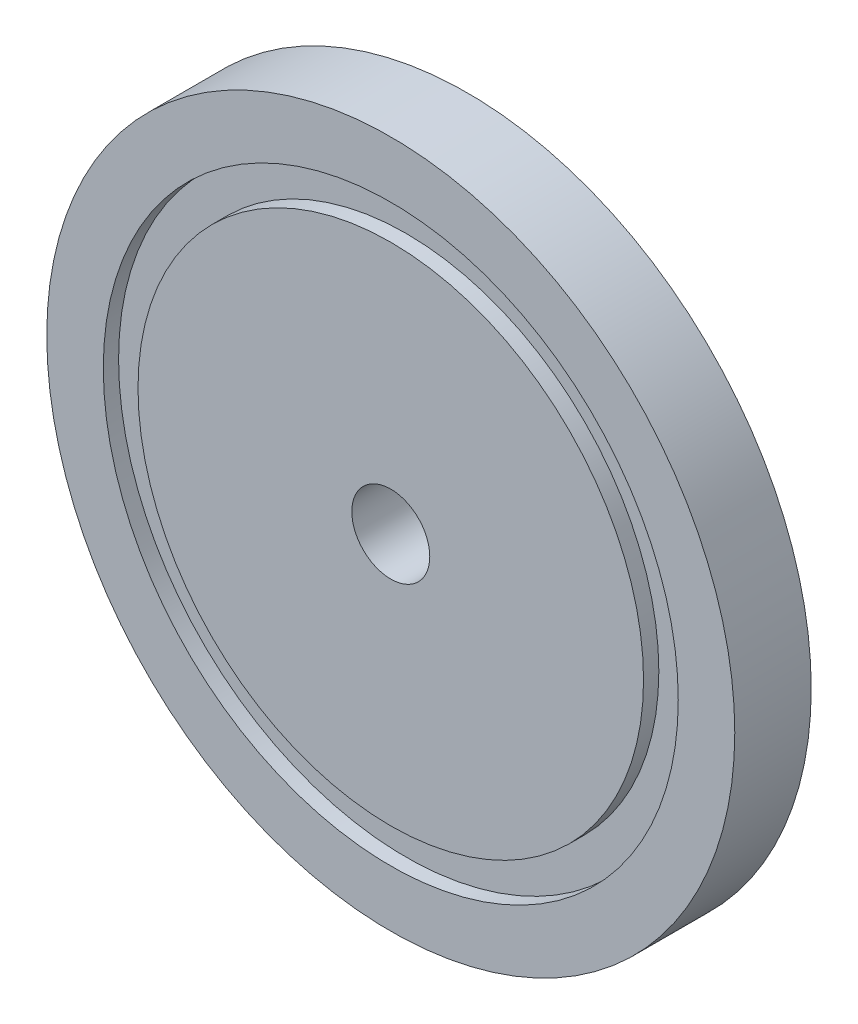
from build123d import *

# Parameters (mm, degrees)
ESQUISSE1_R             = 22.5
BOSS_EXTRU_1_DEPTH      = 5
ESQUISSE6_R             = 2.55
ENL_V_MAT_EXTRU_4_DEPTH = 5
ESQUISSE7_R             = 18.80314531
ESQUISSE7_R_2           = 16.53251654
ENL_V_MAT_EXTRU_5_DEPTH = 1


with BuildPart() as part:
    # Esquisse1 → Boss.-Extru.1 (new body)
    with BuildSketch(Plane.XY):
        Circle(ESQUISSE1_R)
    extrude(amount=BOSS_EXTRU_1_DEPTH)

    # Esquisse6 → Enlèv. mat.-Extru.4 (cut)
    with BuildSketch(Plane.XY.offset(5)):
        Circle(ESQUISSE6_R)
    extrude(amount=-ENL_V_MAT_EXTRU_4_DEPTH, mode=Mode.SUBTRACT)

    # Esquisse7 → Enlèv. mat.-Extru.5 (cut)
    with BuildSketch(Plane.XY.offset(5)):
        Circle(ESQUISSE7_R)
        Circle(ESQUISSE7_R_2, mode=Mode.SUBTRACT)
    extrude(amount=-ENL_V_MAT_EXTRU_5_DEPTH, mode=Mode.SUBTRACT)


solid = part.part
